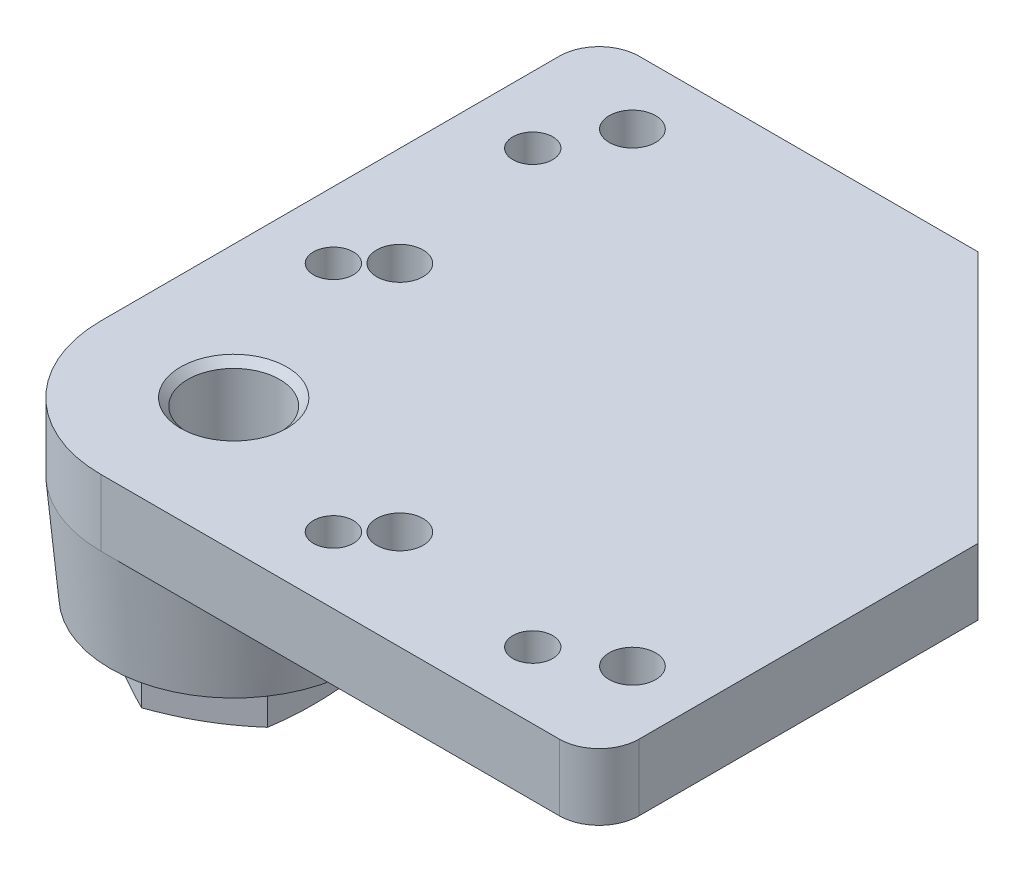
from build123d import *

# Parameters (mm, degrees)
SKETCH_1_R          = 3.5
SKETCH_1_R_2        = 3
EXTRUDE_1_DEPTH     = 10
SKETCH_2_R          = 20
EXTRUDE_2_DEPTH     = 16
EXTRUDE_2_DRAFT     = -5
SKETCH_4_W          = 48
SKETCH_4_H          = 48
CUT_EXTRUDE_1_DEPTH = 16
EXTRUDE_3_DEPTH     = 2
EXTRUDE_3_DRAFT     = -10


with BuildPart() as part:
    # 草图1 → 凸台-拉伸1 (new body)
    with BuildSketch(Plane(origin=(0, 0, 0), x_dir=(1, 0, 0), z_dir=(0, 1, 0))):
        with BuildLine():
            Line((0, -20), (69, -20))
            ThreePointArc((69, -20), (73.242640687, -18.242640687), (75, -14))
            Line((75, -14), (75, 37))
            Line((75, 37), (37, 75))
            Line((37, 75), (-14, 75))
            ThreePointArc((-14, 75), (-18.242640687, 73.242640687), (-20, 69))
            Line((-20, 69), (-20, 0))
            ThreePointArc((-20, 0), (-14.142135624, -14.142135624), (0, -20))
        make_face()
        with Locations((65, -5)):
            Circle(SKETCH_1_R, mode=Mode.SUBTRACT)
        with Locations((55, -10)):
            Circle(SKETCH_1_R_2, mode=Mode.SUBTRACT)
        with Locations((30, -5)):
            Circle(SKETCH_1_R, mode=Mode.SUBTRACT)
        with Locations((25, -10)):
            Circle(SKETCH_1_R_2, mode=Mode.SUBTRACT)
        with Locations((-5, 30)):
            Circle(SKETCH_1_R, mode=Mode.SUBTRACT)
        with Locations((-5, 65)):
            Circle(SKETCH_1_R, mode=Mode.SUBTRACT)
        with Locations((-10, 25)):
            Circle(SKETCH_1_R_2, mode=Mode.SUBTRACT)
        with Locations((-10, 55)):
            Circle(SKETCH_1_R_2, mode=Mode.SUBTRACT)
    extrude(amount=-EXTRUDE_1_DEPTH)


with BuildPart() as extrude_2_tool:
    # 草图2 → 凸台-拉伸2 (with draft: the straight prism first)
    with BuildSketch(Plane(origin=(0, -10, 0), x_dir=(1, 0, 0), z_dir=(0, 1, 0))):
        Circle(SKETCH_2_R)
    extrude(amount=-EXTRUDE_2_DEPTH)
    # 凸台-拉伸2: the draft: its side faces are tilted about the plane it starts from
    extrude_2_sides = [extrude_2_tool.faces().sort_by_distance(p)[0] for p in [
        (-20, -18, 0),
    ]]
    draft(extrude_2_sides, Plane(origin=(0, -10, 0), x_dir=(1, 0, 0), z_dir=(0, 1, 0)), EXTRUDE_2_DRAFT)


with BuildPart() as part_1:
    add(part.part)

    # 凸台-拉伸2: add extrude_2_tool
    add(extrude_2_tool.part)

    # 草图3 → 旋转1 (revolve)
    with BuildSketch(Plane.XY):
        Polygon((0, -26), (12, -26), (14.4, -26.643078062), (14.4, -33.356921938), (12, -34), (0, -34), align=None)
    revolve(axis=Axis((0, -34, 0), (0, 1, 0)))

    # 草图4 → 切除-拉伸1 (cut)
    with BuildSketch(Plane(origin=(0, -26, 0), x_dir=(1, 0, 0), z_dir=(0, 1, 0))):
        Rectangle(SKETCH_4_W, SKETCH_4_H)
        Polygon((-12, -6.92820323), (0, -13.856406461), (12, -6.92820323), (12, 6.92820323), (0, 13.856406461), (-12, 6.92820323), align=None, mode=Mode.SUBTRACT)
    extrude(amount=-CUT_EXTRUDE_1_DEPTH, mode=Mode.SUBTRACT)

    # 草图5 → 切除-旋转1 (revolve, cut)
    with BuildSketch(Plane.XY):
        Polygon((0, 0), (8, 0), (6.9175, -1.0825), (6.9175, -32.9175), (8, -34), (0, -34), align=None)
    revolve(axis=Axis((0, -34, 0), (0, 1, 0)), mode=Mode.SUBTRACT)


with BuildPart() as extrude_3_tool:
    # 草图6 → 凸台-拉伸3 (with draft: the straight prism first)
    with BuildSketch(Plane(origin=(0, -10, 0), x_dir=(1, 0, 0), z_dir=(0, 1, 0))):
        with BuildLine():
            Line((6.573950263, 34.573950263), (34.573950263, 6.573950263))
            ThreePointArc((34.573950263, 6.573950263), (38.109484168, 5.109484168), (41.645018074, 6.573950263))
            Line((41.645018074, 6.573950263), (69.929289322, 34.85822151))
            ThreePointArc((69.929289322, 34.85822151), (71.393755416, 38.393755416), (69.929289322, 41.929289322))
            Line((69.929289322, 41.929289322), (41.929289322, 69.929289322))
            ThreePointArc((41.929289322, 69.929289322), (38.393755416, 71.393755416), (34.85822151, 69.929289322))
            Line((34.85822151, 69.929289322), (6.573950263, 41.645018074))
            ThreePointArc((6.573950263, 41.645018074), (5.109484168, 38.109484168), (6.573950263, 34.573950263))
        make_face()
    extrude(amount=-EXTRUDE_3_DEPTH)
    # 凸台-拉伸3: the draft: its side faces are tilted about the plane it starts from
    extrude_3_sides = [extrude_3_tool.faces().sort_by_distance(p)[0] for p in [
        (20.573950263, -11, -20.573950263),
        (38.109484168, -11, -5.109484168),
        (55.787153698, -11, -20.716085886),
        (71.393755416, -11, -38.393755416),
        (55.929289322, -11, -55.929289322),
        (38.393755416, -11, -71.393755416),
        (20.716085886, -11, -55.787153698),
        (5.109484168, -11, -38.109484168),
    ]]
    draft(extrude_3_sides, Plane(origin=(0, -10, 0), x_dir=(1, 0, 0), z_dir=(0, 1, 0)), EXTRUDE_3_DRAFT)


with BuildPart() as part_2:
    add(part_1.part)

    # 凸台-拉伸3: add extrude_3_tool
    add(extrude_3_tool.part)

    # 草图7 → 旋转2 (revolve)
    with BuildSketch(Plane(origin=(0, 0, 0), x_dir=(0.7071067811865476, 0, -0.7071067811865475), z_dir=(0.7071067811865475, 0, 0.7071067811865476))):
        with BuildLine():
            Line((55, -12), (75, -12))
            Line((75, -12), (72.585786438, -14.414213562))
            ThreePointArc((72.585786438, -14.414213562), (71.93693974, -14.847759065), (71.171572875, -15))
            Line((71.171572875, -15), (55, -15))
            Line((55, -15), (55, -12))
        make_face()
    revolve(axis=Axis((38.890872965, -15, -38.890872965), (0, 1, 0)))


solid = part_2.part
